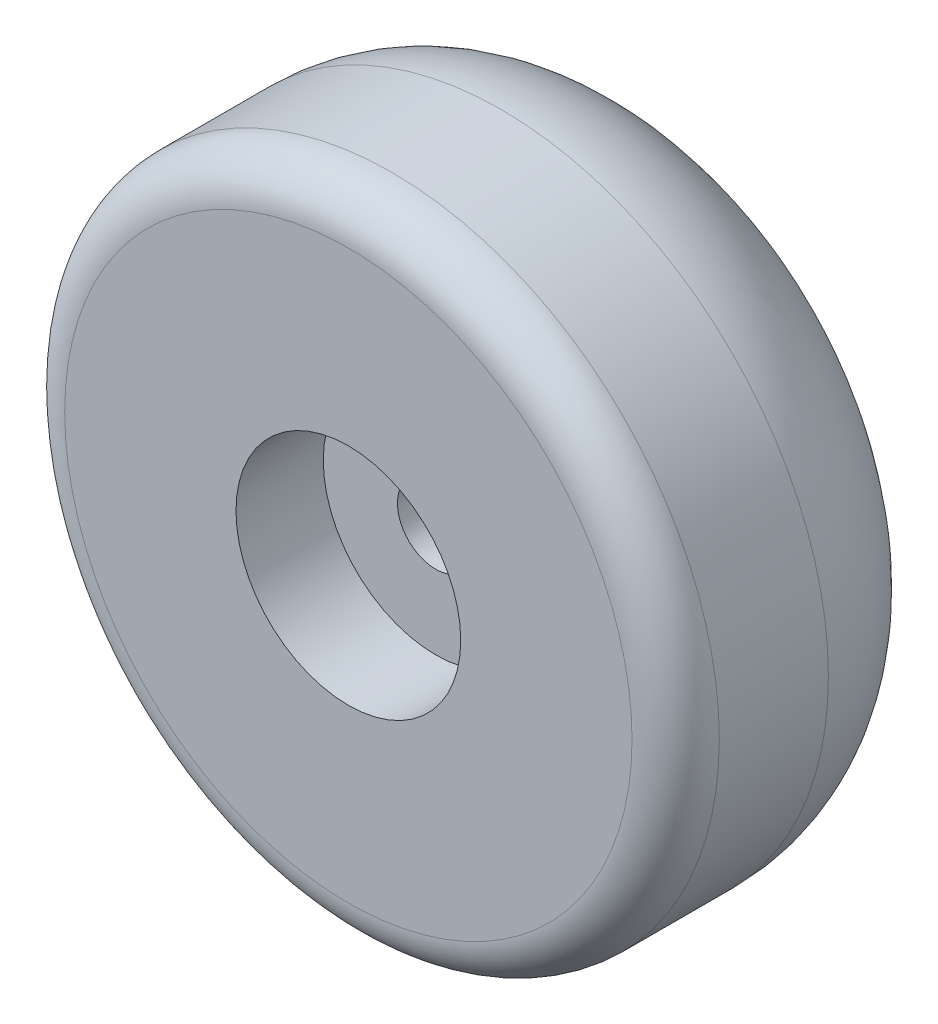
from build123d import *

# Parameters (mm, degrees)
SKETCH_1_R          = 15
SKETCH_1_R_2        = 1.75
EXTRUDE_1_DEPTH     = 14
SKETCH_2_R          = 5.15
CUT_EXTRUDE_1_DEPTH = 4
FILLET_1_R          = 2
FILLET_2_R          = 7


with BuildPart() as part:
    # Эскиз1 → Бобышка-Вытянуть1 (new body)
    with BuildSketch(Plane.XY):
        Circle(SKETCH_1_R)
        Circle(SKETCH_1_R_2, mode=Mode.SUBTRACT)
    extrude(amount=EXTRUDE_1_DEPTH)

    # Эскиз2 → Вырез-Вытянуть1 (cut)
    with BuildSketch(Plane.XY.offset(14)):
        Circle(SKETCH_2_R)
    extrude(amount=-CUT_EXTRUDE_1_DEPTH, mode=Mode.SUBTRACT)

    # Скругление1
    fillet_1_edges = [part.edges().sort_by_distance(p)[0] for p in [
        (-15, 0, 14),
    ]]
    fillet(fillet_1_edges, radius=FILLET_1_R)

    # Скругление2
    fillet_2_edges = [part.edges().sort_by_distance(p)[0] for p in [
        (-15, 0, 0),
    ]]
    fillet(fillet_2_edges, radius=FILLET_2_R)


solid = part.part
